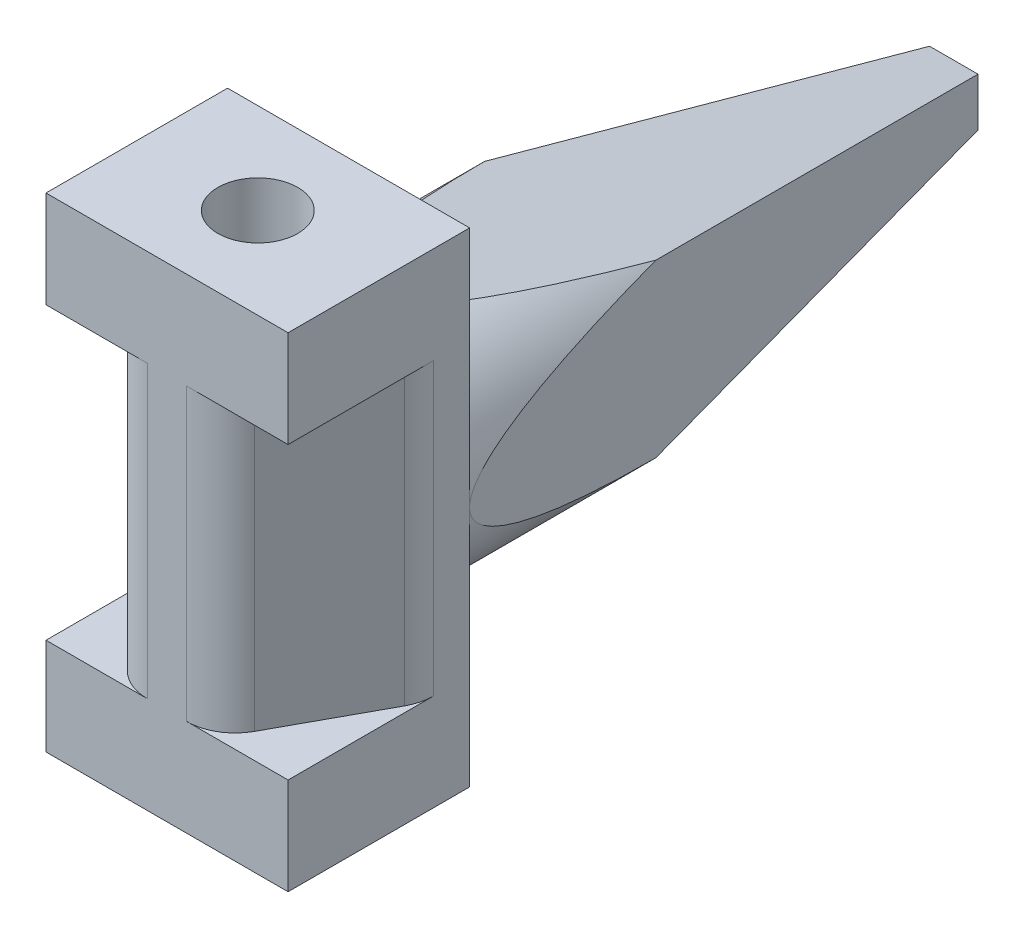
from build123d import *

# Parameters (mm, degrees)
BOSS_EXTRUDE1_DEPTH = 12
BOSS_EXTRUDE2_START = 4
SKETCH2_W           = 10
SKETCH2_H           = 7.500000000000002
SKETCH2_R           = 1.65
BOSS_EXTRUDE2_DEPTH = 4
SKETCH3_W           = 10
SKETCH3_H           = 7.499999999999999
SKETCH3_R           = 1.6500000000000001
BOSS_EXTRUDE3_DEPTH = 4
SKETCH4_R           = 5.000000000000002
BOSS_EXTRUDE4_DEPTH = 25
CUT_EXTRUDE1_DEPTH  = 38.579914848227105
CUT_EXTRUDE2_DEPTH  = 40.44933459514875


with BuildPart() as part:
    # Sketch1 → Boss-Extrude1 (new body)
    with BuildSketch(Plane(origin=(0, 0, 0), x_dir=(1, 0, 0), z_dir=(0, 1, 0))):
        with BuildLine():
            Line((-5, 7.5), (-10, 7.499999999999999))
            Line((-10, 7.499999999999999), (-10, 6.009988028713897))
            ThreePointArc((-10, 6.009988028713897), (-9.937986363684939, 5.515813106068849), (-9.755791145828766, 5.052283767352735))
            Line((-9.755791145828766, 5.052283767352735), (-7.56852494834847, 1.0422957386388614))
            ThreePointArc((-7.56852494834847, 1.042295738638861), (-6.83366266323373, 0.2802022614966764), (-5.812733802519688, -8.9e-16))
            Line((-5.812733802519688, 0), (-5, 0))
            Line((-5, 0), (-5, 2.0999999999999996))
            ThreePointArc((-5.000000000000002, 2.0999999999999996), (-6.65, 3.7500000000000004), (-5, 5.3999999999999995))
            Line((-5, 5.3999999999999995), (-5, 7.5))
        make_face()
        with BuildLine():
            Line((0, 7.5), (-5, 7.5))
            Line((-5, 7.5), (-5, 5.3999999999999995))
            ThreePointArc((-5, 5.3999999999999995), (-3.8332738110421967, 4.916726188957803), (-3.35, 3.7499999999999996))
            ThreePointArc((-3.35, 3.749999999999999), (-3.833273811042198, 2.583273811042195), (-5.000000000000002, 2.0999999999999996))
            Line((-5, 2.0999999999999996), (-5, 0))
            Line((-5, 0), (-4.187266197480313, 0))
            ThreePointArc((-4.187266197480313, -8.9e-16), (-3.1663373367662704, 0.2802022614966755), (-2.4314750516515296, 1.0422957386388605))
            Line((-2.43147505165153, 1.0422957386388614), (-0.24420885417123472, 5.052283767352735))
            ThreePointArc((-0.24420885417123483, 5.052283767352735), (-0.06201363631506229, 5.515813106068849), (0, 6.009988028713897))
            Line((0, 6.009988028713897), (0, 7.5))
        make_face()
    extrude(amount=BOSS_EXTRUDE1_DEPTH)

    # Sketch2 → Boss-Extrude2 (add)
    with BuildSketch(Plane.XZ.offset(BOSS_EXTRUDE2_START)):
        with Locations((-5, -3.75)):
            Rectangle(SKETCH2_W, SKETCH2_H)
        with Locations(Location((-4.999999999999999, -3.75, 0), (0, 0, 270))):
            Circle(SKETCH2_R, mode=Mode.SUBTRACT)
    extrude(amount=-BOSS_EXTRUDE2_DEPTH)

    # Sketch3 → Boss-Extrude3 (add)
    with BuildSketch(Plane(origin=(0, 12, 0), x_dir=(1, 0, 0), z_dir=(0, 1, 0))):
        with Locations((-5, 3.7499999999999996)):
            Rectangle(SKETCH3_W, SKETCH3_H)
        with Locations(Location((-4.999999999999999, 3.7499999999999982, 0), (0, 0, 90))):
            Circle(SKETCH3_R, mode=Mode.SUBTRACT)
    extrude(amount=BOSS_EXTRUDE3_DEPTH)

    # Sketch4 → Boss-Extrude4 (add)
    with BuildSketch(Plane(origin=(-6.5e-16, 0, -7.5), x_dir=(-1, 0, 9e-17), z_dir=(-9e-17, 0, -1))):
        with Locations((5, 6)):
            Circle(SKETCH4_R)
    extrude(amount=BOSS_EXTRUDE4_DEPTH)

    # Sketch5 → Cut-Extrude1 (cut, through all)
    with BuildSketch(Plane(origin=(0, 0, 0), x_dir=(0, 0, -1), z_dir=(1, 0, 0))):
        Polygon((32.5, 11.000000000000002), (7.5, 11), (32.5, 7), align=None)
        Polygon((32.5, 0.9999999999999991), (32.5, 5), (7.5, 0.9999999999999991), align=None)
    extrude(amount=-CUT_EXTRUDE1_DEPTH, mode=Mode.SUBTRACT)

    # Sketch6 → Cut-Extrude2 (cut, through all)
    with BuildSketch(Plane(origin=(0, -4, 0), x_dir=(-1, 0, 0), z_dir=(0, -1, 0))):
        Polygon((3.47e-15, 7.5), (4.000000000000004, 32.50000000000002), (3.92e-15, 32.500000000000014), align=None)
        Polygon((10.000000000000009, 32.500000000000014), (6.000000000000004, 32.500000000000014), (10, 7.5), align=None)
    extrude(amount=-CUT_EXTRUDE2_DEPTH, mode=Mode.SUBTRACT)


solid = part.part
